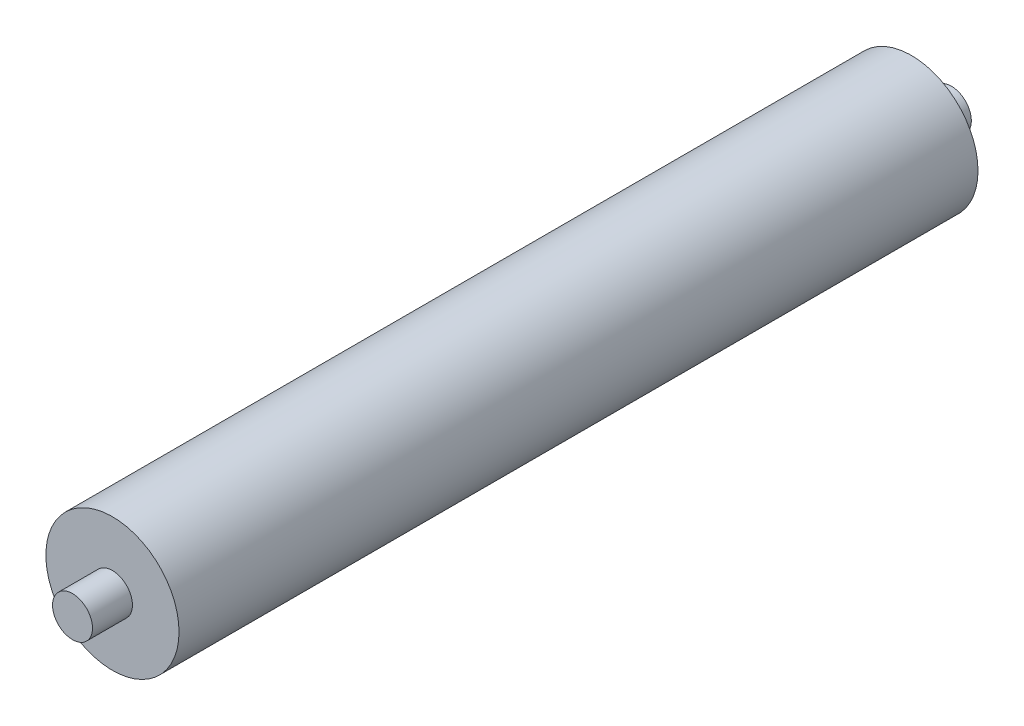
from build123d import *

# Parameters (mm, degrees)
SKETCH1_R           = 25
BOSS_EXTRUDE1_DEPTH = 150
SHELL1_T            = 5
SKETCH2_R           = 7.5
BOSS_EXTRUDE2_DEPTH = 15


with BuildPart() as part:
    # Sketch1 → Boss-Extrude1 (new, symmetric)
    with BuildSketch(Plane.XY):
        Circle(SKETCH1_R)
    extrude(amount=BOSS_EXTRUDE1_DEPTH, both=True)

    # Shell1 (no face opened: a closed hollow body)
    add(offset(amount=-SHELL1_T, mode=Mode.PRIVATE), mode=Mode.SUBTRACT)

    # Sketch2 → Boss-Extrude2 (add)
    with BuildSketch(Plane.XY.offset(150)):
        Circle(SKETCH2_R)
    boss_extrude2 = extrude(amount=BOSS_EXTRUDE2_DEPTH)

    # Mirror1: Boss-Extrude2 across plane
    add(boss_extrude2.mirror(Plane.XY))


solid = part.part
